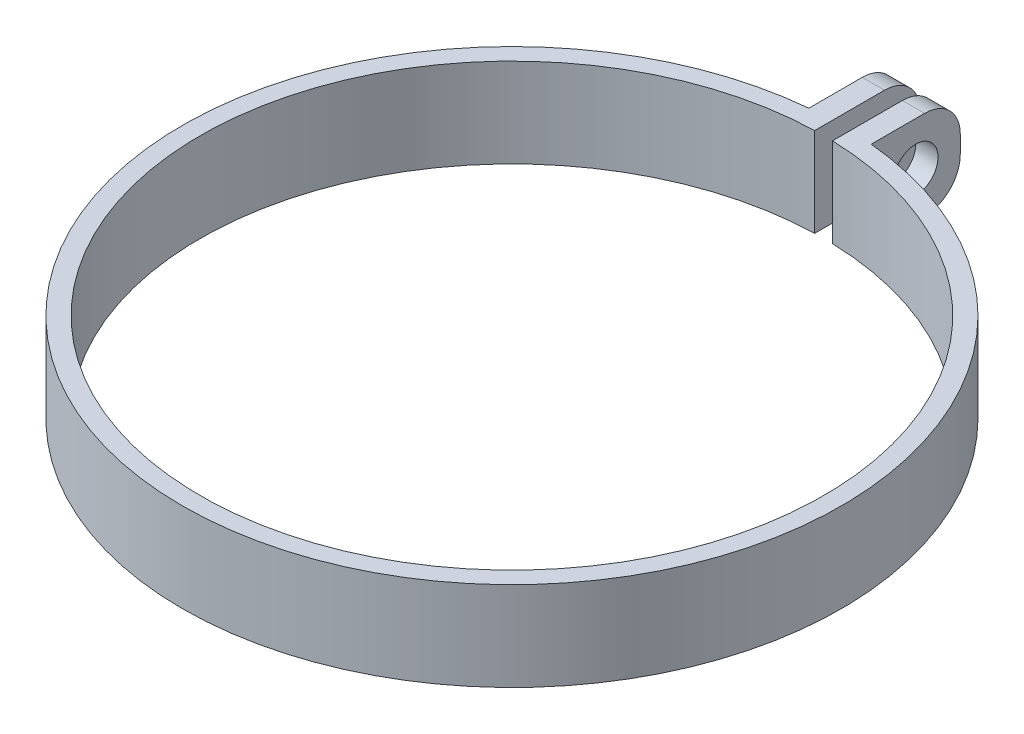
from build123d import *

# Parameters (mm, degrees)
SALIENTE_EXTRUIR1_DEPTH = 10
CROQUIS2_R              = 2.5
CORTAR_EXTRUIR1_DEPTH   = 10
REDONDEO1_R             = 4


with BuildPart() as part:
    # Croquis1 → Saliente-Extruir1 (new body)
    with BuildSketch(Plane(origin=(0, 0, 0), x_dir=(1, 0, 0), z_dir=(0, 1, 0))):
        with BuildLine():
            Line((-1, 34.985711369), (-1, 46.834087473))
            Line((-1, 46.834087473), (-3.5, 46.834087473))
            Line((-3.5, 46.834087473), (-3.5, 36.834087473))
            ThreePointArc((-3.5, 36.834087473), (0, -37), (3.5, 36.834087473))
            Line((3.5, 36.834087473), (3.5, 46.834087473))
            Line((3.5, 46.834087473), (1, 46.834087473))
            Line((1, 46.834087473), (1, 34.985711369))
            ThreePointArc((1, 34.985711369), (0, -35), (-1, 34.985711369))
        make_face()
    extrude(amount=SALIENTE_EXTRUIR1_DEPTH)

    # Croquis2 → Cortar-Extruir1 (cut)
    with BuildSketch(Plane.ZY.offset(3.5)):
        with Locations((-41.834087473, 5)):
            Circle(CROQUIS2_R)
    extrude(amount=-CORTAR_EXTRUIR1_DEPTH, mode=Mode.SUBTRACT)

    # Redondeo1
    redondeo1_edges = [part.edges().sort_by_distance(p)[0] for p in [
        (-2.25, 0, -46.834087473),
        (-2.25, 10, -46.834087473),
        (2.25, 10, -46.834087473),
        (2.25, 0, -46.834087473),
    ]]
    fillet(redondeo1_edges, radius=REDONDEO1_R)


solid = part.part
